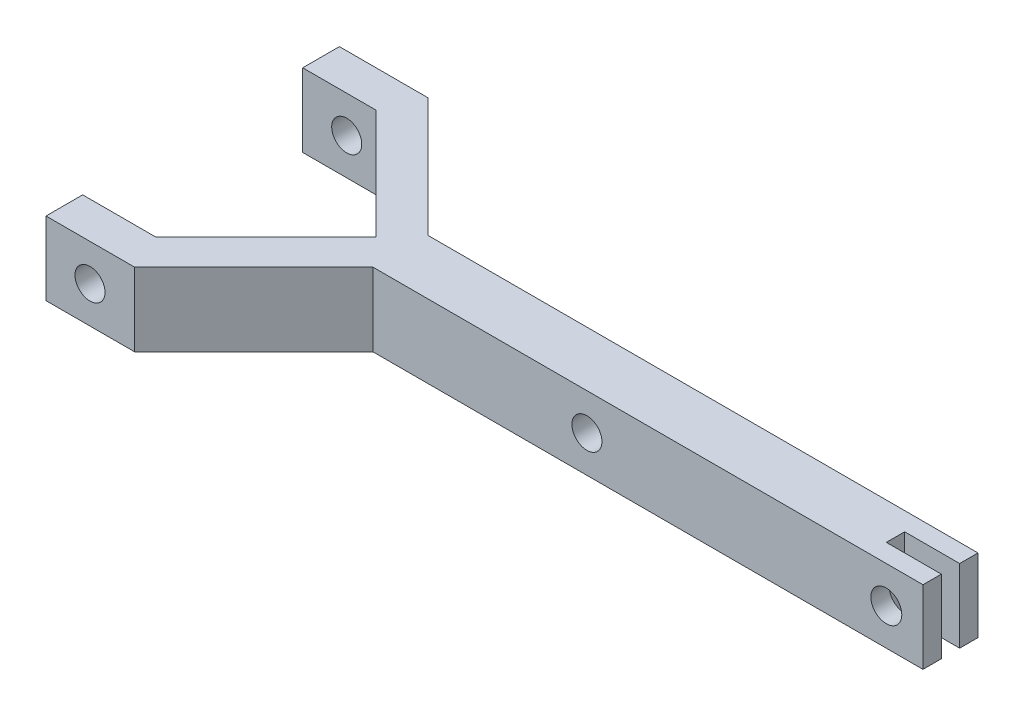
from build123d import *

# Parameters (mm, degrees)
ESQUISSE1_W             = 12.7
ESQUISSE1_H             = 12.7
BOSS_EXTRU_1_DEPTH      = 4.7625
ESQUISSE2_R             = 2.6
ENL_V_MAT_EXTRU_1_DEPTH = 14.090860361
ESQUISSE4_W             = 9.525
ESQUISSE4_H             = 12.7
BOSS_EXTRU_3_DEPTH      = 51.8414
ESQUISSE5_R             = 2.6797
ENL_V_MAT_EXTRU_2_DEPTH = 60.306721027
ESQUISSE6_W             = 9.525
ESQUISSE6_H             = 3.175
ENL_V_MAT_EXTRU_3_DEPTH = 60.751237981
ESQUISSE7_W             = 9.525
ESQUISSE7_H             = 12.7
BOSS_EXTRU_4_DEPTH      = 34.925
BOSS_EXTRU_5_DEPTH      = 12.7
ESQUISSE9_R             = 2.6
ENL_V_MAT_EXTRU_4_DEPTH = 90.183031598


with BuildPart() as part:
    # Esquisse1 → Boss.-Extru.1 (new, symmetric)
    with BuildSketch(Plane.XY):
        Rectangle(ESQUISSE1_W, ESQUISSE1_H)
    extrude(amount=BOSS_EXTRU_1_DEPTH, both=True)

    # Esquisse2 → Enlèv. mat.-Extru.1 (cut, through all)
    with BuildSketch(Plane.XY.offset(4.7625)):
        Circle(ESQUISSE2_R)
    extrude(amount=-ENL_V_MAT_EXTRU_1_DEPTH, mode=Mode.SUBTRACT)

    # Esquisse4 → Boss.-Extru.3 (add)
    with BuildSketch(Plane(origin=(6.35, 0, 0), x_dir=(0, 0, -1), z_dir=(1, 0, 0))):
        Rectangle(ESQUISSE4_W, ESQUISSE4_H)
    extrude(amount=BOSS_EXTRU_3_DEPTH)

    # Esquisse5 → Enlèv. mat.-Extru.2 (cut, through all)
    with BuildSketch(Plane.XY.offset(4.7625)):
        with Locations((51.8414, 0)):
            Circle(ESQUISSE5_R)
    extrude(amount=-ENL_V_MAT_EXTRU_2_DEPTH, mode=Mode.SUBTRACT)

    # Esquisse6 → Enlèv. mat.-Extru.3 (cut, through all)
    with BuildSketch(Plane(origin=(0, 6.35, 0), x_dir=(1, 0, 0), z_dir=(0, 1, 0))):
        with Locations((53.4289, 0)):
            Rectangle(ESQUISSE6_W, ESQUISSE6_H)
    extrude(amount=-ENL_V_MAT_EXTRU_3_DEPTH, mode=Mode.SUBTRACT)

    # Esquisse7 → Boss.-Extru.4 (add)
    with BuildSketch(Plane.ZY.offset(6.35)):
        Rectangle(ESQUISSE7_W, ESQUISSE7_H)
    extrude(amount=BOSS_EXTRU_4_DEPTH)

    # Esquisse8 → Boss.-Extru.5 (add)
    with BuildSketch(Plane(origin=(0, 6.35, 0), x_dir=(1, 0, 0), z_dir=(0, 1, 0))):
        Polygon((-37.057243879, 4.7625), (-57.694743879, 25.4), (-73.025, 25.4), (-73.025, 19.05), (-60.325, 19.05), (-41.275, 0), (-60.325, -19.05), (-73.025, -19.05), (-73.025, -25.4), (-57.694743879, -25.4), (-37.057243879, -4.7625), align=None)
    extrude(amount=-BOSS_EXTRU_5_DEPTH)

    # Esquisse9 → Enlèv. mat.-Extru.4 (cut, through all)
    with BuildSketch(Plane.XY.offset(25.4)):
        with Locations((-65.405, 0)):
            Circle(ESQUISSE9_R)
    extrude(amount=-ENL_V_MAT_EXTRU_4_DEPTH, mode=Mode.SUBTRACT)


solid = part.part
